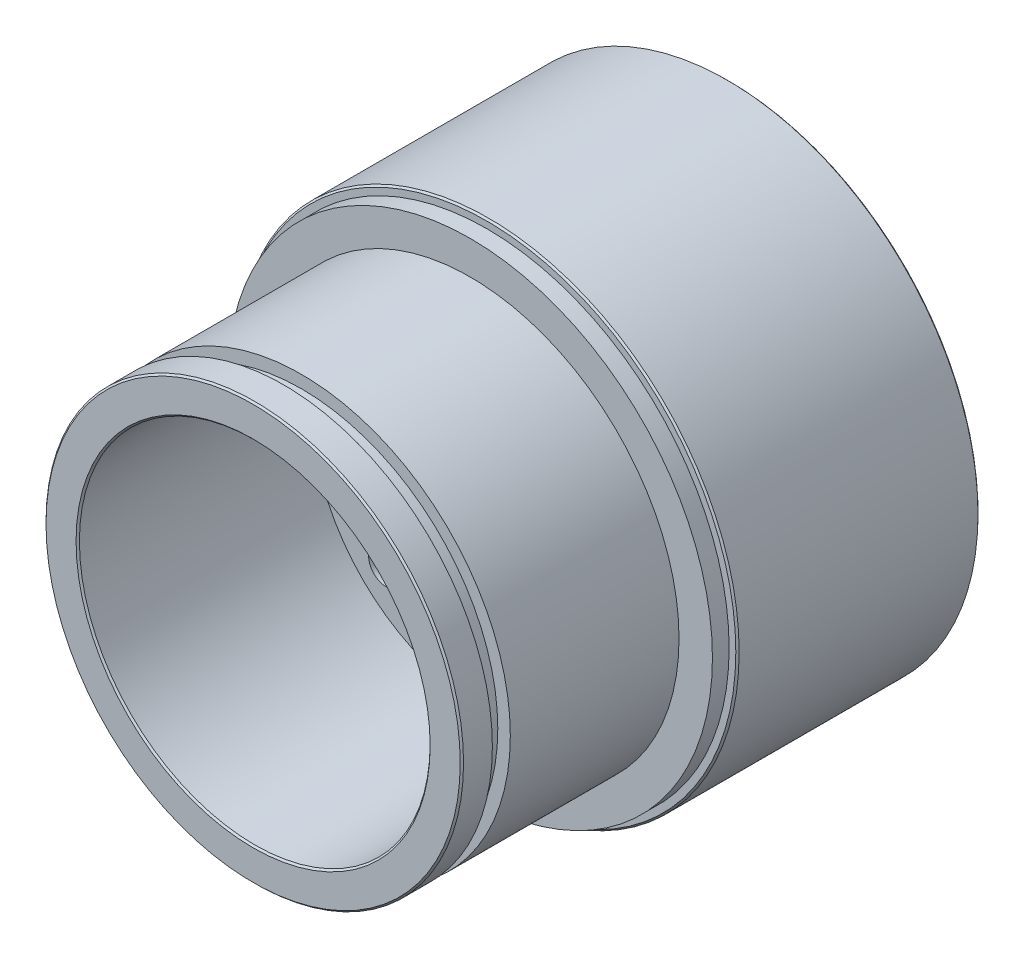
from build123d import *

# Parameters (mm, degrees)
SKETCH2_W            = 1.5
SKETCH2_H            = 2.15
CHAMFER1_SIZE        = 0.2
M4_CLEARANCE_HOLE1_D = 4.3
CIRPATTERN1_COUNT    = 4
CIRPATTERN3_COUNT    = 6


with BuildPart() as part:
    # Sketch1 → Revolve1 (revolve)
    with BuildSketch(Plane(origin=(0, 0, 0), x_dir=(1, 0, 0), z_dir=(0, 1, 0))):
        Polygon((13, 0), (21, 0), (21, -28), (25, -28), (25, -2), (29, -2), (29, 0), (30, 0), (30, 29), (20.5, 29), (20.5, 4), (13, 4), align=None)
    revolve(axis=Axis((0, 0, 0), (0, 0, -1)))

    # Sketch2 → Cut-Revolve1 (revolve, cut)
    with BuildSketch(Plane(origin=(0, 0, 0), x_dir=(1, 0, 0), z_dir=(0, 1, 0))):
        with Locations((24.25, -23.275)):
            Rectangle(SKETCH2_W, SKETCH2_H)
    revolve(axis=Axis((0, 0, 0), (0, 0, 1)), mode=Mode.SUBTRACT)

    # Chamfer1
    chamfer1_edges = [part.edges().sort_by_distance(p)[0] for p in [
        (-30, 0, 0),
        (-25, 0, 28),
        (-21, 0, 28),
        (-20.5, 0, -29),
        (-30, 0, -29),
    ]]
    chamfer(chamfer1_edges, length=CHAMFER1_SIZE)

    # M4 Clearance Hole1 (through all)
    with Locations(Plane.XY):
        with Locations((-12.02081528, 12.02081528)):
            m4_clearance_hole1 = Hole(M4_CLEARANCE_HOLE1_D / 2)

    # CirPattern1: M4 Clearance Hole1 ×4 about axis
    cirpattern1_axis = Axis((0, 0, 0), (0, 0, 1))
    for i in range(1, CIRPATTERN1_COUNT):
        add(m4_clearance_hole1.rotate(cirpattern1_axis, i * 360 / CIRPATTERN1_COUNT), mode=Mode.SUBTRACT)

    # Sketch9 → M4 Tapped Hole1 (revolve, cut)
    with BuildSketch(Plane(origin=(0, 25, -29), x_dir=(0, 1, 0), z_dir=(1, 0, 0))):
        Polygon((0, 0), (0, 11.091420021), (1.65, 10.1), (1.65, 0), align=None)
    m4_tapped_hole1 = revolve(axis=Axis((0, 25, -35.35), (0, 0, 1)), mode=Mode.SUBTRACT)

    # CirPattern3: M4 Tapped Hole1 ×6 about axis
    cirpattern3_axis = Axis((0, 0, 0), (0, 0, 1))
    for i in range(1, CIRPATTERN3_COUNT):
        add(m4_tapped_hole1.rotate(cirpattern3_axis, i * 360 / CIRPATTERN3_COUNT), mode=Mode.SUBTRACT)


solid = part.part
